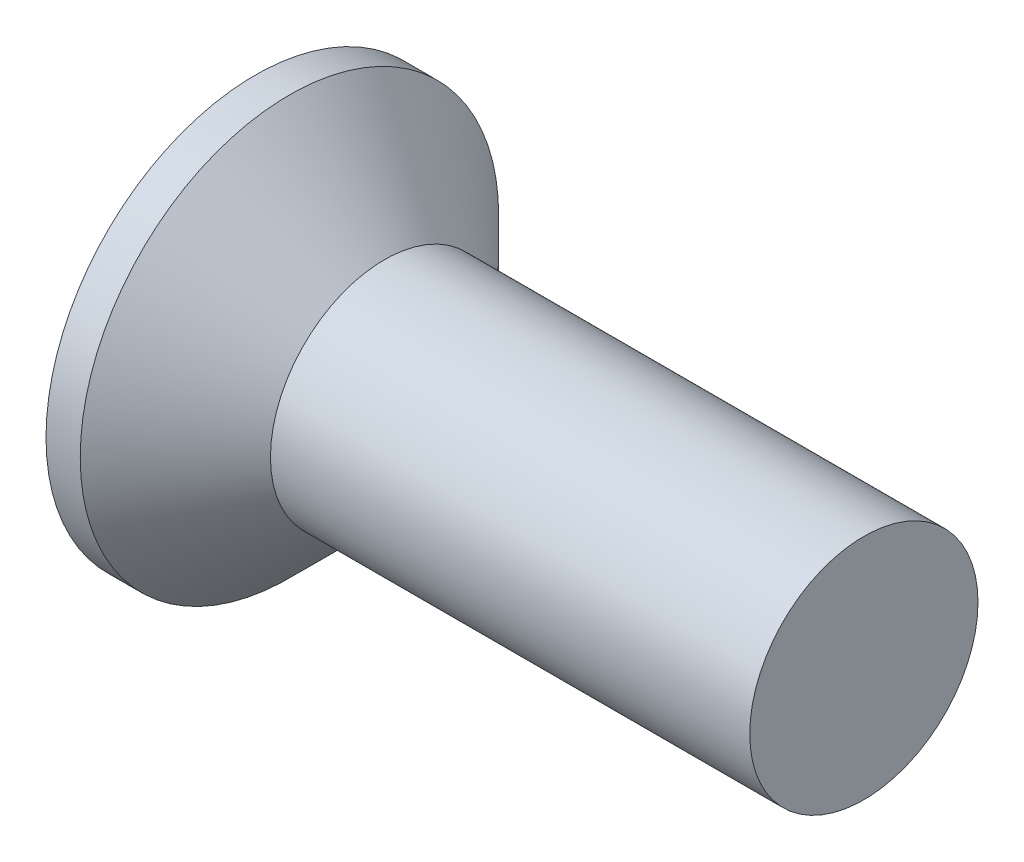
from build123d import *

# Parameters (mm, degrees)
CIRPATTERN1_COUNT = 2
CIRPATTERN1_ANGLE = 90


with BuildPart() as part:
    # BodySke → Base-Revolve (revolve)
    with BuildSketch(Plane.XY, mode=Mode.PRIVATE) as base_revolve_sk:
        Polygon((0, 0), (0, 2.75), (0.45, 2.75), (1.7, 1.5), (8, 1.5), (8, 0), align=None)
    revolve(base_revolve_sk.sketch.rotate(Axis((-6.35, 0, 0), (1, 0, 0)), 90), axis=Axis((-6.35, 0, 0), (1, 0, 0)))

    # Sketch3 → Cross section 0
    with BuildSketch(Plane.ZY):
        with BuildLine():
            Line((-0.395, 1.55), (0.395, 1.55))
            Line((0.395, 1.55), (0.395, -1.55))
            Line((0.395, -1.55), (-0.395, -1.55))
            Line((-0.395, -1.55), (-0.395, 1.55))
        make_face()
    # Sketch4 → Cross section 1
    with BuildSketch(Plane.ZY.offset(-2.08)):
        with BuildLine():
            Line((-0.1975, 0.1975), (0.1975, 0.1975))
            Line((0.1975, 0.1975), (0.1975, -0.1975))
            Line((0.1975, -0.1975), (-0.1975, -0.1975))
            Line((-0.1975, -0.1975), (-0.1975, 0.1975))
        make_face()
    cross = loft(mode=Mode.SUBTRACT)

    # CirPattern1: Cross ×2 about axis
    cirpattern1_axis = Axis((0, 0, 0), (1, 0, 0))
    for i in range(1, CIRPATTERN1_COUNT):
        add(cross.rotate(cirpattern1_axis, i * CIRPATTERN1_ANGLE / (CIRPATTERN1_COUNT - 1)), mode=Mode.SUBTRACT)


solid = part.part
